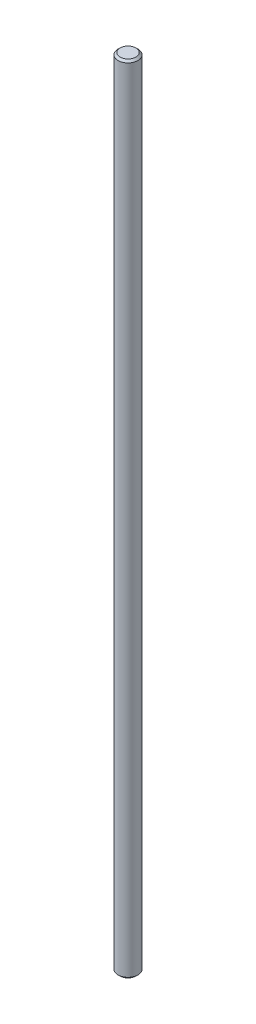
from build123d import *

# Parameters (mm, degrees)
SKETCH_1_R      = 5
EXTRUDE_1_DEPTH = 400
CHAMFER_1_SIZE  = 1


with BuildPart() as part:
    # 草图1 → 凸台-拉伸1 (new body)
    with BuildSketch(Plane(origin=(0, 0, 0), x_dir=(1, 0, 0), z_dir=(0, 1, 0))):
        with Locations(Location((0, 0, 0), (0, 0, 270))):
            Circle(SKETCH_1_R)
    extrude(amount=EXTRUDE_1_DEPTH)

    # 倒角1
    chamfer_1_edges = [part.edges().sort_by_distance(p)[0] for p in [
        (0, 0, -5),
        (0, 400, -5),
    ]]
    chamfer(chamfer_1_edges, length=CHAMFER_1_SIZE)


solid = part.part
